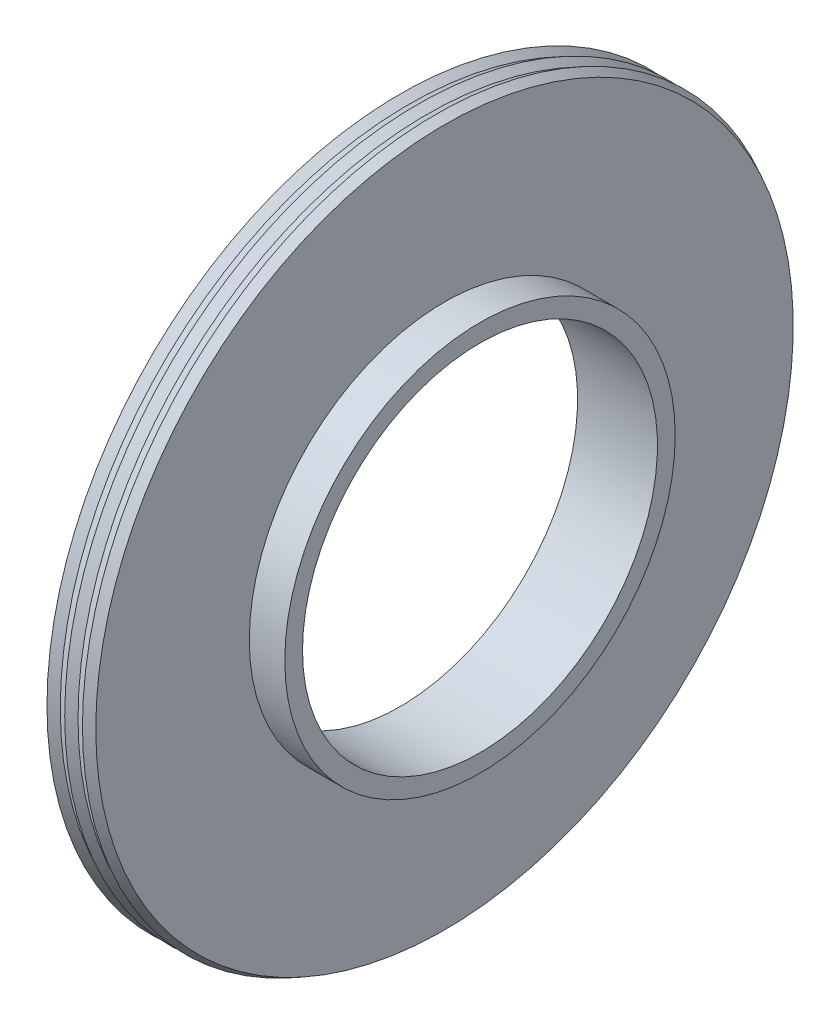
from build123d import *


with BuildPart() as part:
    # 草图1 → 旋转1 (revolve)
    with BuildSketch(Plane.XY, mode=Mode.PRIVATE) as revolve_1_sk:
        Polygon((0, 20), (9, 20), (9, 22), (5, 22), (5, 39.3), (4, 39.8), (3, 39.3), (2, 39.8), (1, 39.3), (0, 39.8), align=None)
    revolve(revolve_1_sk.sketch.rotate(Axis((-51.877615745, 0, 0), (1, 0, 0)), 90), axis=Axis((-51.877615745, 0, 0), (1, 0, 0)))


solid = part.part
